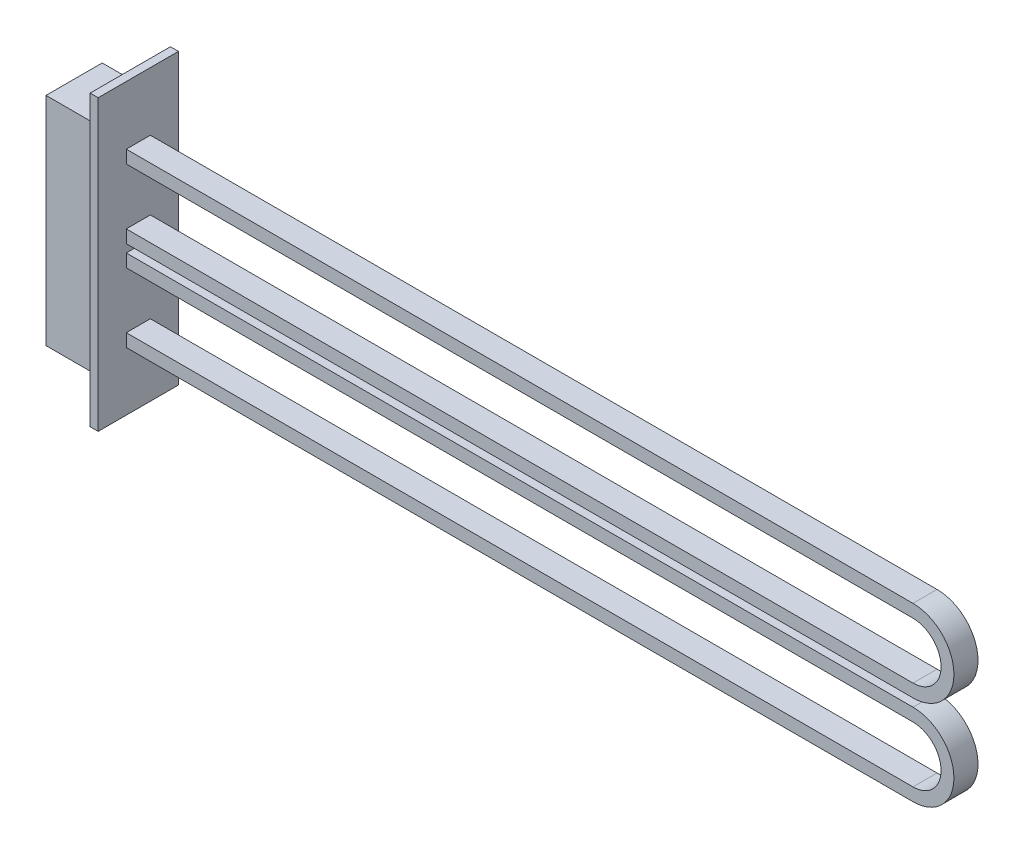
from build123d import *

# Parameters (mm, degrees)
BOSS_EXTRUDE1_DEPTH   = 15
BOSS_EXTRUDE1_2_DEPTH = 15
SKETCH3_R             = 2.5
BOSS_EXTRUDE2_DEPTH   = 15
BOSS_EXTRUDE2_2_DEPTH = 15
BOSS_EXTRUDE2_3_DEPTH = 15
BOSS_EXTRUDE2_4_DEPTH = 15
SKETCH5_W             = 50
SKETCH5_H             = 180
BOSS_EXTRUDE3_DEPTH   = 5
SKETCH7_W             = 35
SKETCH7_H             = 135
BOSS_EXTRUDE4_DEPTH   = 35


with BuildPart() as part:
    # Sketch1 → Boss-Extrude1 (new body)
    with BuildSketch(Plane.XY):
        with BuildLine():
            Line((500, -43), (0, -43))
            Line((0, -43), (0, -35))
            Line((0, -35), (8, -35))
            Line((8, -35), (500, -35))
            ThreePointArc((500, -35), (517.5, -17.5), (500, 0))
            Line((500, 0), (8, 0))
            Line((8, 0), (0, 0))
            Line((0, 0), (0, 8))
            Line((0, 8), (500, 8))
            ThreePointArc((500, 8), (525.5, -17.5), (500, -43))
        make_face()
    extrude(amount=BOSS_EXTRUDE1_DEPTH)



with BuildPart() as body_2:
    # Sketch1 → Boss-Extrude1 2 (new body)
    with BuildSketch(Plane.XY):
        with BuildLine():
            Line((8, -56), (0, -56))
            Line((0, -56), (0, -48))
            Line((0, -48), (500, -48))
            ThreePointArc((500, -48), (525.5, -73.5), (500, -99))
            Line((500, -99), (0, -99))
            Line((0, -99), (0, -91))
            Line((0, -91), (8, -91))
            Line((8, -91), (500, -91))
            ThreePointArc((500, -91), (517.5, -73.5), (500, -56))
            Line((500, -56), (8, -56))
        make_face()
    extrude(amount=BOSS_EXTRUDE1_2_DEPTH)


with BuildPart() as body_3:
    # Sketch3 → Boss-Extrude2 (new body)
    with BuildSketch(Plane.ZY):
        with Locations(Location((7.5, 4, 0), (0, 0, 270))):
            Circle(SKETCH3_R)
    extrude(amount=BOSS_EXTRUDE2_DEPTH)


with BuildPart() as body_4:
    # Sketch3 → Boss-Extrude2 2 (new body)
    with BuildSketch(Plane.ZY):
        with Locations(Location((7.5, -39, 0), (0, 0, 90))):
            Circle(SKETCH3_R)
    extrude(amount=BOSS_EXTRUDE2_2_DEPTH)


with BuildPart() as body_5:
    # Sketch3 → Boss-Extrude2 3 (new body)
    with BuildSketch(Plane.ZY):
        with Locations(Location((7.5, -52, 0), (0, 0, 270))):
            Circle(SKETCH3_R)
    extrude(amount=BOSS_EXTRUDE2_3_DEPTH)


with BuildPart() as body_6:
    # Sketch3 → Boss-Extrude2 4 (new body)
    with BuildSketch(Plane.ZY):
        with Locations(Location((7.5, -95, 0), (0, 0, 90))):
            Circle(SKETCH3_R)
    extrude(amount=BOSS_EXTRUDE2_4_DEPTH)


with BuildPart() as part_1:
    add(part.part)

    add(body_2.part)  # Boss-Extrude3 merges body 2
    # Sketch5 → Boss-Extrude3 (add)
    with BuildSketch(Plane(origin=(10, 0, 0), x_dir=(0, 0, -1), z_dir=(1, 0, 0))):
        with Locations((-7.5, -45.5)):
            Rectangle(SKETCH5_W, SKETCH5_H)
    extrude(amount=-BOSS_EXTRUDE3_DEPTH)


with BuildPart() as body_6_2:
    # Sketch7 → Boss-Extrude4 (new body)
    with BuildSketch(Plane.ZY.offset(-5)):
        with Locations((7.5, -45.5)):
            Rectangle(SKETCH7_W, SKETCH7_H)
    extrude(amount=BOSS_EXTRUDE4_DEPTH)


solid = Compound([body_3.part, body_4.part, body_5.part, body_6.part, part_1.part, body_6_2.part])
